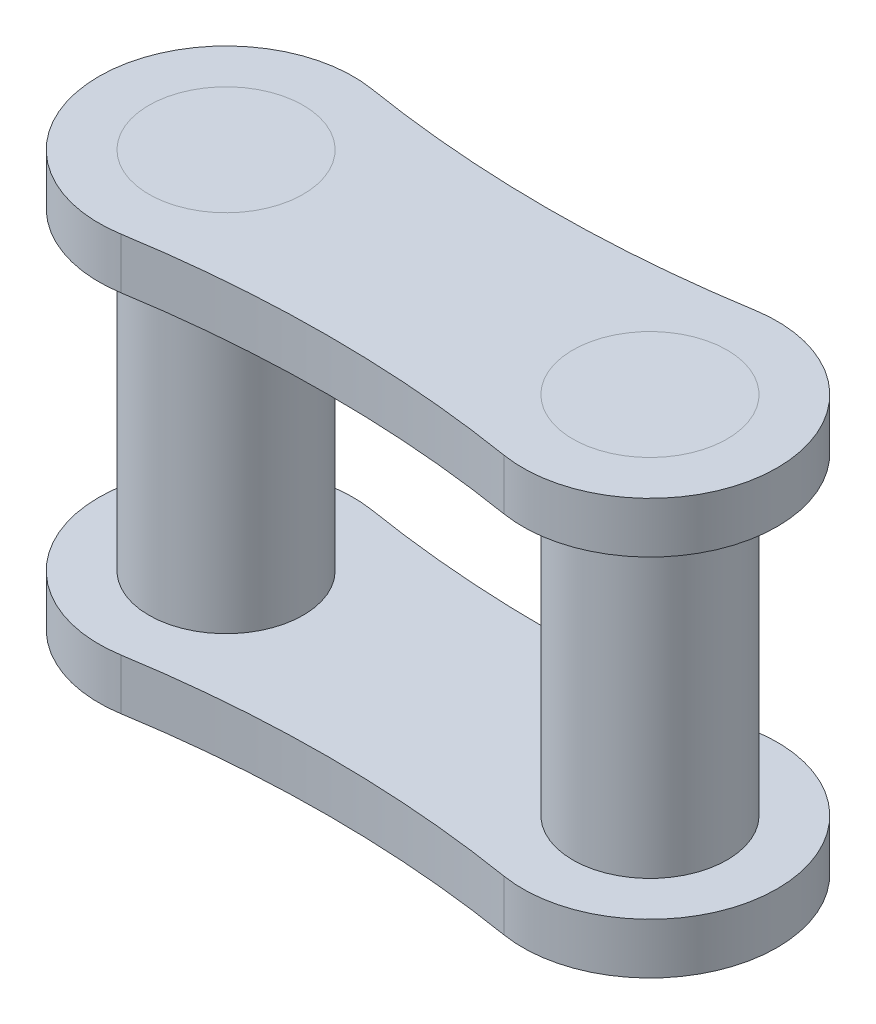
from build123d import *

# Parameters (mm, degrees)
BOSS_EXTRUDE1_DEPTH        = 0.762
SKETCH2_R                  = 1.1557
CUT_EXTRUDE1_DEPTH         = 4.699
BOSS_EXTRUDE3_DEPTH        = 4.699
BOSS_EXTRUDE3_DEPTH_BACK   = 0.762
SKETCH2_2_R                = 1.1557
BOSS_EXTRUDE3_2_DEPTH      = 4.699
BOSS_EXTRUDE3_2_DEPTH_BACK = 0.762
SKETCH3_R                  = 1.1557
BOSS_EXTRUDE4_DEPTH        = 0.762
SKETCH4_R                  = 1.1557
BOSS_EXTRUDE6_DEPTH        = 0.762
BOSS_EXTRUDE6_2_DEPTH      = 0.762


with BuildPart() as part:
    # Sketch1 → Boss-Extrude1 (new body)
    with BuildSketch(Plane(origin=(0, 0, 0), x_dir=(1, 0, 0), z_dir=(0, 1, 0))):
        with BuildLine():
            ThreePointArc((-2.867741935, 1.88005784), (-5.08, 0), (-2.867741935, -1.88005784))
            ThreePointArc((-2.867741935, -1.88005784), (0, -1.647264347), (2.867741935, -1.88005784))
            ThreePointArc((2.867741935, -1.88005784), (5.08, 0), (2.867741935, 1.88005784))
            ThreePointArc((2.867741935, 1.88005784), (0, 1.647264347), (-2.867741935, 1.88005784))
        make_face()
    extrude(amount=BOSS_EXTRUDE1_DEPTH)

    # Sketch2 → Cut-Extrude1 (cut)
    with BuildSketch(Plane(origin=(0, 0.762, 0), x_dir=(1, 0, 0), z_dir=(0, 1, 0))):
        with Locations((3.175, 0)):
            Circle(SKETCH2_R)
        with Locations((-3.175, 0)):
            Circle(SKETCH2_R)
    extrude(amount=-CUT_EXTRUDE1_DEPTH, mode=Mode.SUBTRACT)


with BuildPart() as body_2:
    # Sketch2<2> → Boss-Extrude3 (new, two sides: drawn at the far end of the back side and taken through both)
    with BuildSketch(Plane(origin=(0, 0.762, 0), x_dir=(1, 0, 0), z_dir=(0, 1, 0)).offset(-BOSS_EXTRUDE3_DEPTH_BACK)):
        with Locations((3.175, 0)):
            Circle(SKETCH2_2_R)
    extrude(amount=BOSS_EXTRUDE3_DEPTH + BOSS_EXTRUDE3_DEPTH_BACK)


with BuildPart() as body_3:
    # Sketch2<2> → Boss-Extrude3 2 (new, two sides: drawn at the far end of the back side and taken through both)
    with BuildSketch(Plane(origin=(0, 0.762, 0), x_dir=(1, 0, 0), z_dir=(0, 1, 0)).offset(-BOSS_EXTRUDE3_2_DEPTH_BACK)):
        with Locations((-3.175, 0)):
            Circle(SKETCH2_2_R)
    extrude(amount=BOSS_EXTRUDE3_2_DEPTH + BOSS_EXTRUDE3_2_DEPTH_BACK)


with BuildPart() as body_4:
    # Sketch3 → Boss-Extrude4 (new body)
    with BuildSketch(Plane(origin=(0, 5.461, 0), x_dir=(1, 0, 0), z_dir=(0, 1, 0))):
        with BuildLine():
            ThreePointArc((-2.867741935, 1.88005784), (0, 1.647264347), (2.867741935, 1.88005784))
            ThreePointArc((2.867741935, 1.88005784), (5.08, 0), (2.867741935, -1.88005784))
            ThreePointArc((2.867741935, -1.88005784), (0, -1.647264347), (-2.867741935, -1.88005784))
            ThreePointArc((-2.867741935, -1.88005784), (-5.08, 0), (-2.867741935, 1.88005784))
        make_face()
        with Locations((3.175, 0)):
            Circle(SKETCH3_R, mode=Mode.SUBTRACT)
        with Locations((-3.175, 0)):
            Circle(SKETCH3_R, mode=Mode.SUBTRACT)
    extrude(amount=BOSS_EXTRUDE4_DEPTH)


with BuildPart() as body_5:
    # Sketch4 → Boss-Extrude6 (new body)
    with BuildSketch(Plane(origin=(0, 5.461, 0), x_dir=(1, 0, 0), z_dir=(0, 1, 0))):
        with Locations((3.175, 0)):
            Circle(SKETCH4_R)
    extrude(amount=BOSS_EXTRUDE6_DEPTH)


with BuildPart() as body_6:
    # Sketch4 → Boss-Extrude6 2 (new body)
    with BuildSketch(Plane(origin=(0, 5.461, 0), x_dir=(1, 0, 0), z_dir=(0, 1, 0))):
        with Locations((-3.175, 0)):
            Circle(SKETCH4_R)
    extrude(amount=BOSS_EXTRUDE6_2_DEPTH)


solid = Compound([part.part, body_2.part, body_3.part, body_4.part, body_5.part, body_6.part])
